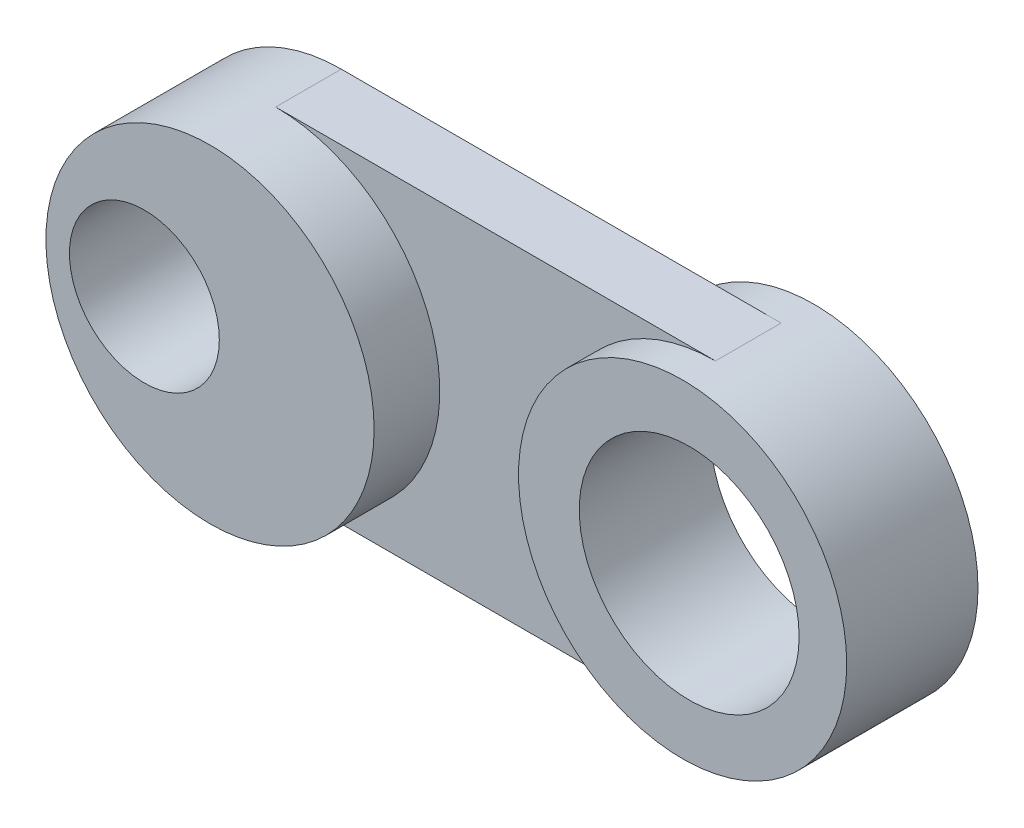
from build123d import *
from build123d.topology import SkipClean

# Parameters (mm, degrees)
SKETCH1_R           = 2.9
SKETCH1_R_2         = 4.2545
BOSS_EXTRUDE1_DEPTH = 1.27
BOSS_EXTRUDE2_START = 2.54
SKETCH2_R           = 2.9
BOSS_EXTRUDE2_DEPTH = 2.54
SKETCH4_R           = 6.35
SKETCH4_R_2         = 4.2545
BOSS_EXTRUDE4_DEPTH = 2.54


with BuildPart() as part:
    # Sketch1 → Boss-Extrude1 (new, symmetric)
    with BuildSketch(Plane.XY):
        with BuildLine():
            Line((0, 12.7), (17.018, 12.7))
            ThreePointArc((17.018, 12.7), (23.368, 6.35), (17.018, 0))
            Line((17.018, 0), (0, 0))
            ThreePointArc((0, 0), (-6.35, 6.35), (0, 12.7))
        make_face()
        with Locations((-2.54, 6.35)):
            Circle(SKETCH1_R, mode=Mode.SUBTRACT)
        with Locations((17.272, 6.35)):
            Circle(SKETCH1_R_2, mode=Mode.SUBTRACT)
    extrude(amount=BOSS_EXTRUDE1_DEPTH, both=True)

    # Sketch2 → Boss-Extrude2 (add)
    with SkipClean():  # the faces are left unmerged after this step: merging them gives an invalid solid
        with BuildSketch(Plane.XY.offset(1.27).offset(BOSS_EXTRUDE2_START)):
            with BuildLine():
                ThreePointArc((0, 0), (4.490128061, 1.859871939), (6.35, 6.35))
                ThreePointArc((6.35, 6.35), (4.490128061, 10.840128061), (0, 12.7))
                ThreePointArc((0, 12.7), (-6.35, 6.35), (0, 0))
            make_face()
            with Locations((-2.54, 6.35)):
                Circle(SKETCH2_R, mode=Mode.SUBTRACT)
        extrude(amount=-BOSS_EXTRUDE2_DEPTH)

    # Sketch4 → Boss-Extrude4 (add, symmetric)
    with SkipClean():  # the faces are left unmerged after this step: merging them gives an invalid solid
        with BuildSketch(Plane.XY):
            with Locations((17.018, 6.35)):
                Circle(SKETCH4_R)
            with Locations((17.272, 6.35)):
                Circle(SKETCH4_R_2, mode=Mode.SUBTRACT)
        extrude(amount=BOSS_EXTRUDE4_DEPTH, both=True)


solid = part.part
